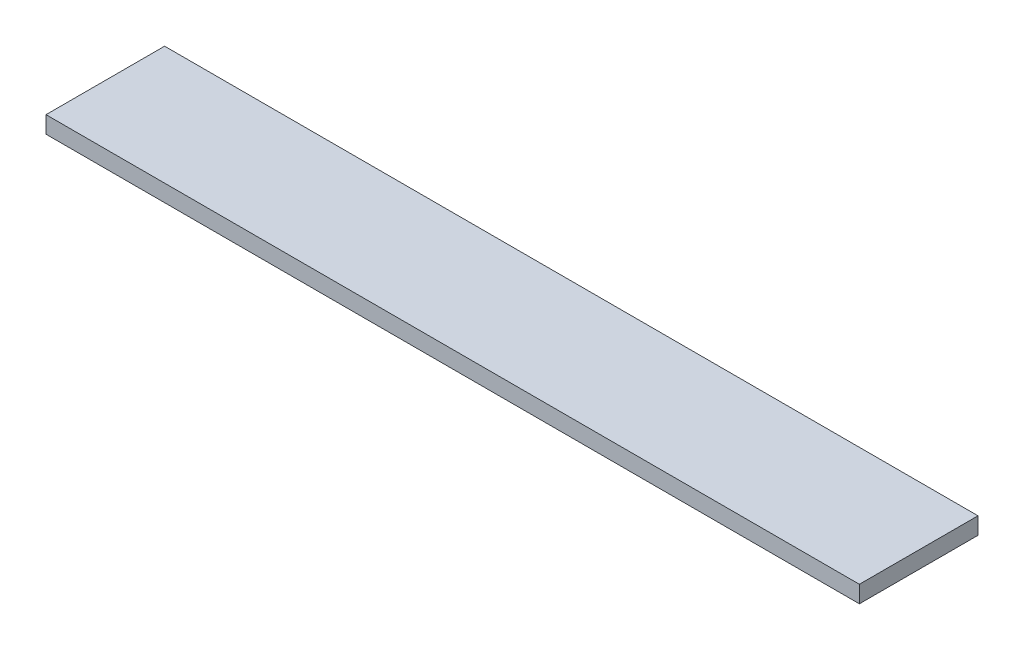
from build123d import *

# Parameters (mm, degrees)
SKETCH1_W           = 609.6
SKETCH1_H           = 88.9
BOSS_EXTRUDE1_DEPTH = 12.7


with BuildPart() as part:
    # Sketch1 → Boss-Extrude1 (new body)
    with BuildSketch(Plane(origin=(0, 0, 0), x_dir=(1, 0, 0), z_dir=(0, 1, 0))):
        with Locations((0, -44.45)):
            Rectangle(SKETCH1_W, SKETCH1_H)
    extrude(amount=BOSS_EXTRUDE1_DEPTH)


solid = part.part
